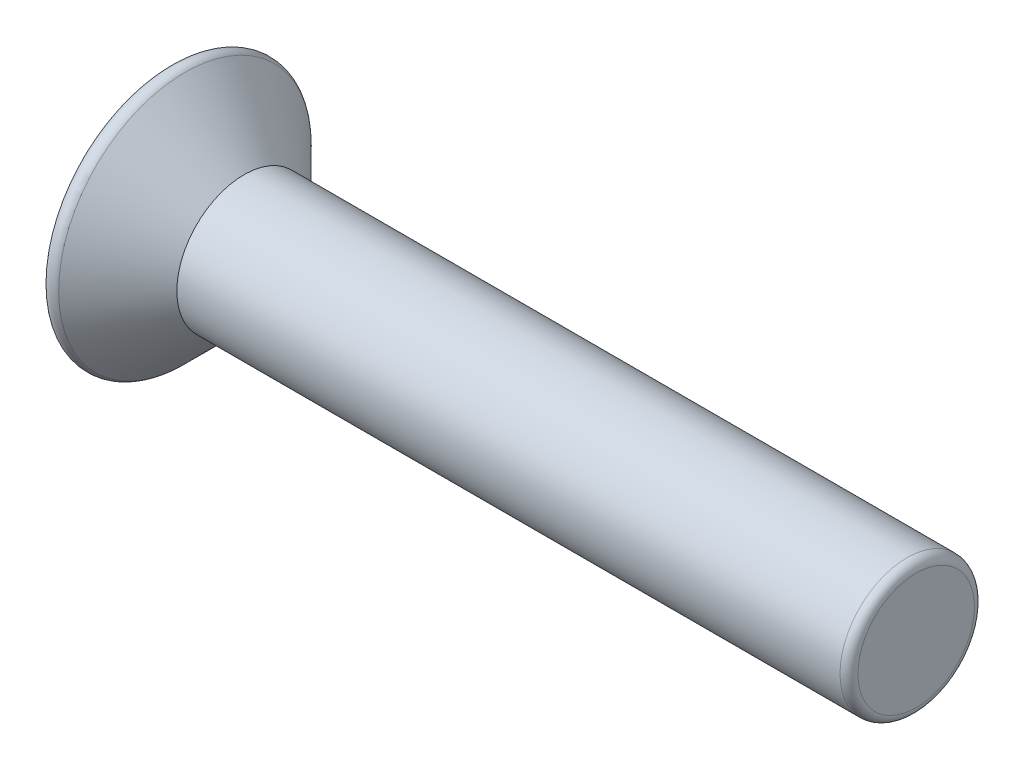
from build123d import *

# Parameters (mm, degrees)
ENL_V_MAT_EXTRU_1_DEPTH = 0.1
CONG_1_R                = 0.2


with BuildPart() as part:
    # Esquisse1 → Révolution1 (revolve)
    with BuildSketch(Plane.XY, mode=Mode.PRIVATE) as r_volution1_sk:
        Polygon((0, 0), (0, 3.16), (1.66, 1.5), (16.66, 1.5), (16.66, 0), align=None)
    revolve(r_volution1_sk.sketch.rotate(Axis((-5.768945874, 0, 0), (1, 0, 0)), 90), axis=Axis((-5.768945874, 0, 0), (1, 0, 0)))

    # Esquisse2 → Enlèv. mat.-Extru.1 (cut)
    with BuildSketch(Plane.ZY):
        Polygon((0, -1.1), (0.952627944, -0.55), (0.952627944, 0.55), (0, 1.1), (-0.952627944, 0.55), (-0.952627944, -0.55), align=None)
    extrude(amount=-ENL_V_MAT_EXTRU_1_DEPTH, mode=Mode.SUBTRACT)

    # Congé1
    cong_1_edges = [part.edges().sort_by_distance(p)[0] for p in [
        (16.66, 0, -1.5),
        (0, 0, -3.16),
    ]]
    fillet(cong_1_edges, radius=CONG_1_R)


solid = part.part
